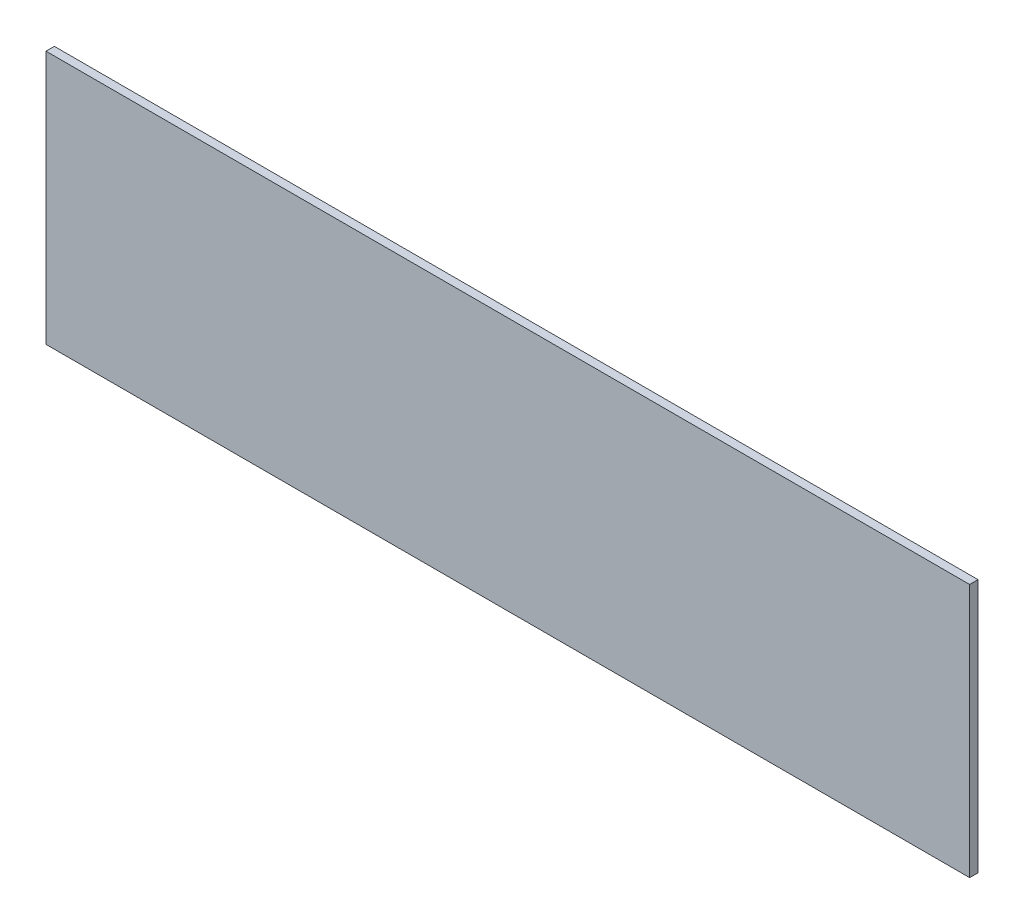
from build123d import *

# Parameters (mm, degrees)
SKETCH_1_W      = 165.5
SKETCH_1_H      = 45.5
EXTRUDE_1_DEPTH = 1.5


with BuildPart() as part:
    # 草图1 → 凸台-拉伸1 (new body)
    with BuildSketch(Plane.XY):
        with Locations((-30.753324334, -11.184405172)):
            Rectangle(SKETCH_1_W, SKETCH_1_H)
    extrude(amount=EXTRUDE_1_DEPTH)


solid = part.part
